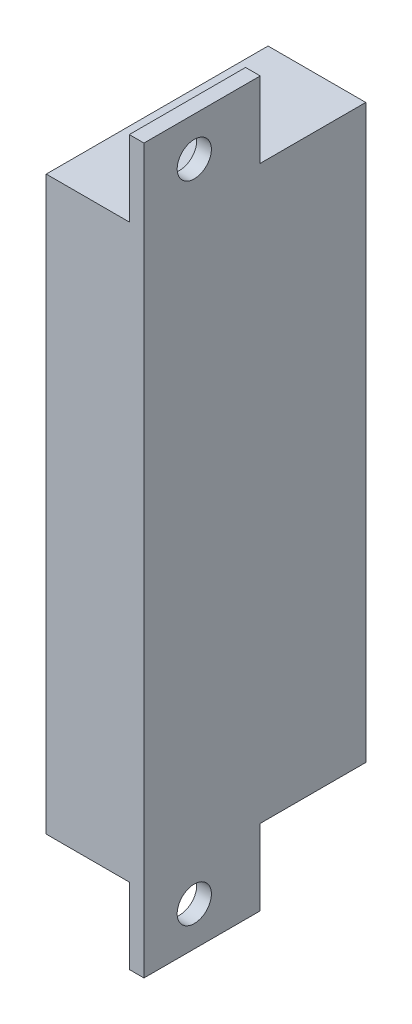
from build123d import *

# Parameters (mm, degrees)
V09_SPEAKER_BODY58P5X22P7X10_START = 23.65
SKETCH_2_W                         = 10
SKETCH_2_H                         = 58.5
V09_SPEAKER_BODY58P5X22P7X10_DEPTH = 22.7
V09_SPEAKER_LOWER_EAR_START        = 34.45
SKETCH_3_W                         = 1.5
SKETCH_3_H                         = 7.75
V09_SPEAKER_LOWER_EAR_DEPTH        = 11.9
V09_SPEAKER_UPPER_EAR_START        = 34.45
SKETCH_4_W                         = 1.5
SKETCH_4_H                         = 7.75
V09_SPEAKER_UPPER_EAR_DEPTH        = 11.9
SKETCH_5_R                         = 1.75
V09_SPEAKER_EAR_D3P5_PITCH66_DEPTH = 1.5


with BuildPart() as part:
    # 草图2 → V09_Speaker_body58p5x22p7x10 (new body)
    with BuildSketch(Plane.XY.offset(V09_SPEAKER_BODY58P5X22P7X10_START)):
        with Locations((150, -73)):
            Rectangle(SKETCH_2_W, SKETCH_2_H)
    extrude(amount=V09_SPEAKER_BODY58P5X22P7X10_DEPTH)

    # 草图3 → V09_Speaker_lower_ear (add)
    with BuildSketch(Plane.XY.offset(V09_SPEAKER_LOWER_EAR_START)):
        with Locations((154.25, -106.125)):
            Rectangle(SKETCH_3_W, SKETCH_3_H)
    extrude(amount=V09_SPEAKER_LOWER_EAR_DEPTH)

    # 草图4 → V09_Speaker_upper_ear (add)
    with BuildSketch(Plane.XY.offset(V09_SPEAKER_UPPER_EAR_START)):
        with Locations((154.25, -39.875)):
            Rectangle(SKETCH_4_W, SKETCH_4_H)
    extrude(amount=V09_SPEAKER_UPPER_EAR_DEPTH)

    # 草图5 → V09_Speaker_ear_D3p5_pitch66 (cut)
    with BuildSketch(Plane(origin=(155, 0, 0), x_dir=(0, 0, -1), z_dir=(1, 0, 0))):
        with Locations((-41.2, -106)):
            Circle(SKETCH_5_R)
        with Locations((-41.2, -40)):
            Circle(SKETCH_5_R)
    extrude(amount=-V09_SPEAKER_EAR_D3P5_PITCH66_DEPTH, mode=Mode.SUBTRACT)


solid = part.part
